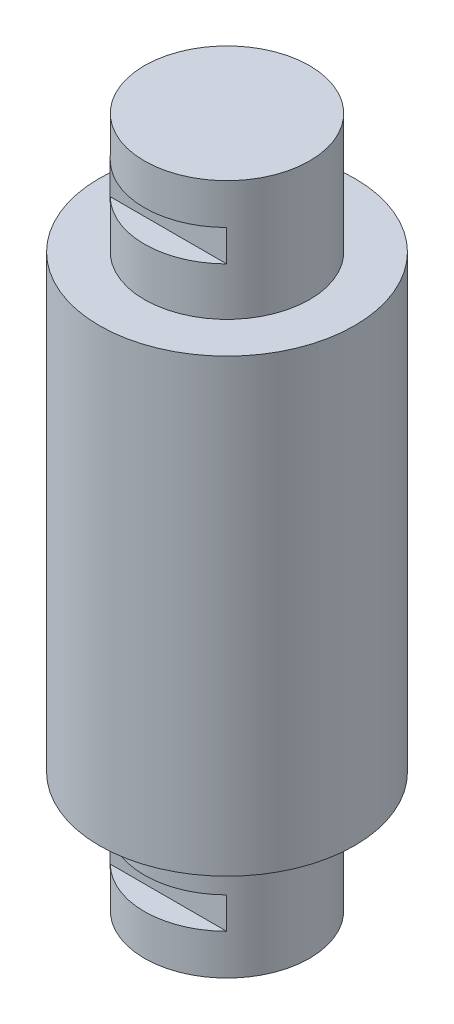
from build123d import *

# Parameters (mm, degrees)
SKETCH1_R           = 42.5
BOSS_EXTRUDE1_DEPTH = 75
SKETCH2_R           = 27.5
BOSS_EXTRUDE2_DEPTH = 40
CUT_EXTRUDE1_DEPTH  = 130.759392724


with BuildPart() as part:
    # Sketch1 → Boss-Extrude1 (new, symmetric)
    with BuildSketch(Plane(origin=(0, 0, 0), x_dir=(-1, 0, 0), z_dir=(0, 1, 0))):
        with Locations(Location((0, 0, 0), (0, 0, 90))):
            Circle(SKETCH1_R)
    extrude(amount=BOSS_EXTRUDE1_DEPTH, both=True)

    # Sketch2 → Boss-Extrude2 (add)
    with BuildSketch(Plane(origin=(0, 75, 0), x_dir=(-1, 0, 0), z_dir=(0, 1, 0))):
        with Locations(Location((0, 0, 0), (0, 0, 90))):
            Circle(SKETCH2_R)
    boss_extrude2 = extrude(amount=BOSS_EXTRUDE2_DEPTH)

    # Sketch3 → Cut-Extrude1 (cut, symmetric)
    with BuildSketch(Plane.YZ):
        Polygon((91, 27.5), (91, 19.5), (101.5, 19.5), (101.5, 27.5), (101.5, 29.5), (91, 29.5), align=None)
    cut_extrude1 = extrude(amount=CUT_EXTRUDE1_DEPTH, both=True, mode=Mode.SUBTRACT)

    # Mirror1: Boss-Extrude2, Cut-Extrude1 across plane
    add(boss_extrude2.mirror(Plane.ZX))
    add(cut_extrude1.mirror(Plane.ZX), mode=Mode.SUBTRACT)


solid = part.part
